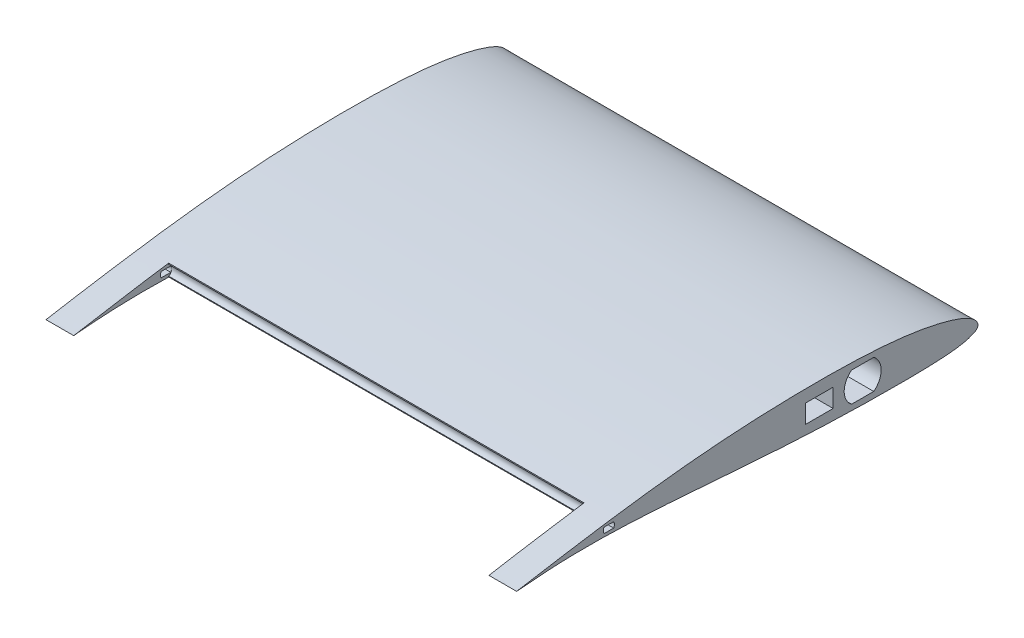
from build123d import *

# Parameters (mm, degrees)
SCHIZZO1_R               = 8
SCHIZZO1_W               = 15
SCHIZZO1_H               = 10
CORPOFOAM_DEPTH          = 225
SCHIZZO2_W               = 5
SCHIZZO2_H               = 6.542892791
SMUSSOPOSTERIORE_DEPTH   = 302.510060719
SCHIZZO3_R               = 8
SCHIZZO3_W               = 15
SCHIZZO3_H               = 10
LATODESTRO_DEPTH         = 15
LATOSINISTRO_START       = 15
SCHIZZO4_R               = 8
SCHIZZO4_W               = 15
SCHIZZO4_H               = 10
LATOSINISTRO_DEPTH       = 15
FOROPERNOALETTONE_DEPTH  = 358.502890584
FOROFOAMLONGHERONE_DEPTH = 15


with BuildPart() as part:
    # Schizzo1 → CorpoFoam (new body)
    with BuildSketch(Plane(origin=(0, 0, 0), x_dir=(0, 0, -1), z_dir=(1, 0, 0))):
        with BuildLine():
            ThreePointArc((-200, 8.059305289), (-196.8581753, 4.91748059), (-200, 1.77565589))
            add(Edge.make_bspline(
                [(-200, 1.77565589), (-196.241450344, 1.678792644), (-188.275993902, 1.377404844), (-175.953687417, 0.706014078), (-162.931424918, -0.160208642), (-149.615771744, -1.148016327), (-136.176354995, -2.19092491), (-122.767140548, -3.219583979), (-109.520053587, -4.152743127), (-96.546095975, -4.938564365), (-83.940819302, -5.536830703), (-71.801839291, -5.947648205), (-60.245256003, -6.218450939), (-49.398732891, -6.355369756), (-39.397226194, -6.381387963), (-30.361934842, -6.26504923), (-22.412181103, -6.012164917), (-15.626227231, -5.597433901), (-10.071907511, -4.928706579), (-5.697692612, -4.040446981), (-2.625320639, -2.865752984), (-0.494884225, -1.71152847), (0.021312549, -0.410454231), (-0.0311692, 0.792659827), (-0.812599242, 2.305684337), (-2.728863517, 4.238352424), (-5.769907241, 6.118172121), (-9.880942804, 7.913594202), (-15.074930468, 9.641318178), (-21.298752222, 11.283896488), (-28.49717212, 12.788381759), (-36.607373406, 14.097834908), (-45.57302844, 15.159429017), (-55.332910074, 15.960903998), (-65.816536498, 16.494069738), (-76.93137626, 16.791989705), (-88.566949028, 16.864754131), (-100.596999886, 16.726715291), (-112.888825982, 16.383385064), (-125.311615819, 15.825573667), (-137.743791097, 15.05233187), (-150.072384382, 14.059339074), (-162.191375056, 12.881586986), (-173.989074322, 11.549280346), (-185.352364446, 10.116249729), (-193.973044007, 8.932981988), (-198.793601378, 8.235543811), (-200, 8.059305289)],
                knots=[0.098689812, 0.098689812, 0.098689812, 0.098689812, 0.120926258, 0.145825281, 0.171670912, 0.198108537, 0.224790184, 0.25139058, 0.277643491, 0.30332675, 0.328257458, 0.352272548, 0.375156062, 0.396620664, 0.416422729, 0.43430442, 0.45005468, 0.463465465, 0.474478994, 0.483169222, 0.489678354, 0.494104066, 0.496910015, 0.497289785, 0.501214273, 0.50645795, 0.513356957, 0.522168632, 0.53296597, 0.545689209, 0.560220779, 0.576438923, 0.594258689, 0.613600245, 0.634342386, 0.656331109, 0.679351894, 0.703152303, 0.727478208, 0.752070739, 0.776691164, 0.801140184, 0.825214387, 0.848697424, 0.871352858, 0.892947449, 0.90015767, 0.90015767, 0.90015767, 0.90015767], degree=3))
        make_face()
        with Locations((-62.499919709, 5.077309939)):
            Circle(SCHIZZO1_R, mode=Mode.SUBTRACT)
        with Locations((-85.999919709, 5.077309939)):
            Rectangle(SCHIZZO1_W, SCHIZZO1_H, mode=Mode.SUBTRACT)
    extrude(amount=CORPOFOAM_DEPTH)

    # Schizzo2 → SmussoPosteriore (cut, through all)
    with BuildSketch(Plane(origin=(225, 0, 0), x_dir=(0, 0, -1), z_dir=(1, 0, 0))):
        with Locations((-201, 5.006075261)):
            Rectangle(SCHIZZO2_W, SCHIZZO2_H)
    extrude(amount=-SMUSSOPOSTERIORE_DEPTH, mode=Mode.SUBTRACT)

    # Schizzo3 → LatoDestro (add)
    with BuildSketch(Plane(origin=(225, 0, 0), x_dir=(0, 0, -1), z_dir=(1, 0, 0))):
        with BuildLine():
            add(Edge.make_bspline(
                [(-250, 0), (-250.000228294, -0.008042796), (-248.284955516, 0.172375658), (-246.518112419, 0.308690015), (-242.189387343, 0.685693594), (-236.806461263, 1.074101529), (-229.680385952, 1.49731724), (-221.184158698, 1.823218603), (-211.337618208, 1.967626101), (-200.371188527, 1.833221056), (-188.499913622, 1.38960529), (-175.953687417, 0.706014078), (-162.931424918, -0.160208642), (-149.615771744, -1.148016327), (-136.176354995, -2.19092491), (-122.767140548, -3.219583979), (-109.520053587, -4.152743127), (-96.546095975, -4.938564365), (-83.940819302, -5.536830703), (-71.801839291, -5.947648205), (-60.245256003, -6.218450939), (-49.398732891, -6.355369756), (-39.397226194, -6.381387963), (-30.361934842, -6.26504923), (-22.412181103, -6.012164917), (-15.626227231, -5.597433901), (-10.071907511, -4.928706579), (-5.697692612, -4.040446981), (-2.625320639, -2.865752984), (-0.494884225, -1.71152847), (0.021312549, -0.410454231), (-0.0311692, 0.792659827), (-0.812599242, 2.305684337), (-2.728863517, 4.238352424), (-5.769907241, 6.118172121), (-9.880942804, 7.913594202), (-15.074930468, 9.641318178), (-21.298752222, 11.283896488), (-28.49717212, 12.788381759), (-36.607373406, 14.097834908), (-45.57302844, 15.159429017), (-55.332910074, 15.960903998), (-65.816536498, 16.494069738), (-76.93137626, 16.791989705), (-88.566949028, 16.864754131), (-100.596999886, 16.726715291), (-112.888825982, 16.383385064), (-125.311615819, 15.825573667), (-137.743791097, 15.05233187), (-150.072384382, 14.059339074), (-162.191375056, 12.881586986), (-173.989074322, 11.549280346), (-185.352364446, 10.116249729), (-196.163081698, 8.632379125), (-206.300441402, 7.131513884), (-215.560350587, 5.731221768), (-223.977157043, 4.293295127), (-231.363413336, 3.181808874), (-237.746440904, 2.098942417), (-242.622069366, 1.245861917), (-246.644529332, 0.552864946), (-248.32839844, 0.246216765), (-249.999773563, 0.007977377), (-250, 0)],
                knots=[0, 0, 0, 0, 0.001588889, 0.006329218, 0.014202456, 0.025172808, 0.039173483, 0.056060631, 0.075578924, 0.097363607, 0.120926258, 0.145825281, 0.171670912, 0.198108537, 0.224790184, 0.25139058, 0.277643491, 0.30332675, 0.328257458, 0.352272548, 0.375156062, 0.396620664, 0.416422729, 0.43430442, 0.45005468, 0.463465465, 0.474478994, 0.483169222, 0.489678354, 0.494104066, 0.496910015, 0.497289785, 0.501214273, 0.50645795, 0.513356957, 0.522168632, 0.53296597, 0.545689209, 0.560220779, 0.576438923, 0.594258689, 0.613600245, 0.634342386, 0.656331109, 0.679351894, 0.703152303, 0.727478208, 0.752070739, 0.776691164, 0.801140184, 0.825214387, 0.848697424, 0.871352858, 0.892947449, 0.913230871, 0.931955467, 0.948342069, 0.963693004, 0.976235918, 0.986320059, 0.993788799, 0.998424035, 1, 1, 1, 1], degree=3))
        make_face()
        with Locations((-62.499919709, 5.077309939)):
            Circle(SCHIZZO3_R, mode=Mode.SUBTRACT)
        with Locations((-85.999919709, 5.077309939)):
            Rectangle(SCHIZZO3_W, SCHIZZO3_H, mode=Mode.SUBTRACT)
    extrude(amount=LATODESTRO_DEPTH)

    # Schizzo4 → LatoSinistro (add)
    with BuildSketch(Plane.ZY.offset(LATOSINISTRO_START)):
        with BuildLine():
            add(Edge.make_bspline(
                [(250, 0), (249.999773563, 0.007977377), (248.32839844, 0.246216765), (246.644529332, 0.552864946), (242.622069366, 1.245861917), (237.746440904, 2.098942417), (231.363413336, 3.181808874), (223.977157043, 4.293295127), (215.560350587, 5.731221768), (206.300441402, 7.131513884), (196.163081698, 8.632379125), (185.352364446, 10.116249729), (173.989074322, 11.549280346), (162.191375056, 12.881586986), (150.072384382, 14.059339074), (137.743791097, 15.05233187), (125.311615819, 15.825573667), (112.888825982, 16.383385064), (100.596999886, 16.726715291), (88.566949028, 16.864754131), (76.93137626, 16.791989705), (65.816536498, 16.494069738), (55.332910074, 15.960903998), (45.57302844, 15.159429017), (36.607373406, 14.097834908), (28.49717212, 12.788381759), (21.298752222, 11.283896488), (15.074930468, 9.641318178), (9.880942804, 7.913594202), (5.769907241, 6.118172121), (2.728863517, 4.238352424), (0.812599242, 2.305684337), (0.0311692, 0.792659827), (-0.021312549, -0.410454231), (0.494884225, -1.71152847), (2.625320639, -2.865752984), (5.697692612, -4.040446981), (10.071907511, -4.928706579), (15.626227231, -5.597433901), (22.412181103, -6.012164917), (30.361934842, -6.26504923), (39.397226194, -6.381387963), (49.398732891, -6.355369756), (60.245256003, -6.218450939), (71.801839291, -5.947648205), (83.940819302, -5.536830703), (96.546095975, -4.938564365), (109.520053587, -4.152743127), (122.767140548, -3.219583979), (136.176354995, -2.19092491), (149.615771744, -1.148016327), (162.931424918, -0.160208642), (175.953687417, 0.706014078), (188.499913622, 1.38960529), (200.371188527, 1.833221056), (211.337618208, 1.967626101), (221.184158698, 1.823218603), (229.680385952, 1.49731724), (236.806461263, 1.074101529), (242.189387343, 0.685693594), (246.518112419, 0.308690015), (248.284955516, 0.172375658), (250.000228294, -0.008042796), (250, 0)],
                knots=[0, 0, 0, 0, 0.001575965, 0.006211201, 0.013679941, 0.023764082, 0.036306996, 0.051657931, 0.068044533, 0.086769129, 0.107052551, 0.128647142, 0.151302576, 0.174785613, 0.198859816, 0.223308836, 0.247929261, 0.272521792, 0.296847697, 0.320648106, 0.343668891, 0.365657614, 0.386399755, 0.405741311, 0.423561077, 0.439779221, 0.454310791, 0.46703403, 0.477831368, 0.486643043, 0.49354205, 0.498785727, 0.502710215, 0.503089985, 0.505895934, 0.510321646, 0.516830778, 0.525521006, 0.536534535, 0.54994532, 0.56569558, 0.583577271, 0.603379336, 0.624843938, 0.647727452, 0.671742542, 0.69667325, 0.722356509, 0.74860942, 0.775209816, 0.801891463, 0.828329088, 0.854174719, 0.879073742, 0.902636393, 0.924421076, 0.943939369, 0.960826517, 0.974827192, 0.985797544, 0.993670782, 0.998411111, 1, 1, 1, 1], degree=3))
        make_face()
        with Locations((62.499919709, 5.077309939)):
            Circle(SCHIZZO4_R, mode=Mode.SUBTRACT)
        with Locations((85.999919709, 5.077309939)):
            Rectangle(SCHIZZO4_W, SCHIZZO4_H, mode=Mode.SUBTRACT)
    extrude(amount=-LATOSINISTRO_DEPTH)

    # Schizzo5 → ForoPernoAlettone (cut, through all)
    with BuildSketch(Plane.ZY.offset(15)):
        with BuildLine():
            Line((197.401923789, 6.41748059), (202.598076211, 6.41748059))
            ThreePointArc((202.598076211, 6.41748059), (203, 4.91748059), (202.598076211, 3.41748059))
            Line((202.598076211, 3.41748059), (197.401923789, 3.41748059))
            ThreePointArc((197.401923789, 3.41748059), (197, 4.91748059), (197.401923789, 6.41748059))
        make_face()
    extrude(amount=-FOROPERNOALETTONE_DEPTH, mode=Mode.SUBTRACT)

    # Schizzo6 → ForoFoamLongherone (cut)
    with BuildSketch(Plane(origin=(240, 0, 0), x_dir=(0, 0, -1), z_dir=(1, 0, 0))):
        with BuildLine():
            Line((-68.499919709, 13.077309939), (-56.499919709, 13.077309939))
            ThreePointArc((-56.499919709, 13.077309939), (-52.499919709, 5.077309939), (-56.499919709, -2.922690061))
            Line((-56.499919709, -2.922690061), (-68.499919709, -2.922690061))
            ThreePointArc((-68.499919709, -2.922690061), (-72.499919709, 5.077309939), (-68.499919709, 13.077309939))
        make_face()
    extrude(amount=-FOROFOAMLONGHERONE_DEPTH, mode=Mode.SUBTRACT)


solid = part.part
